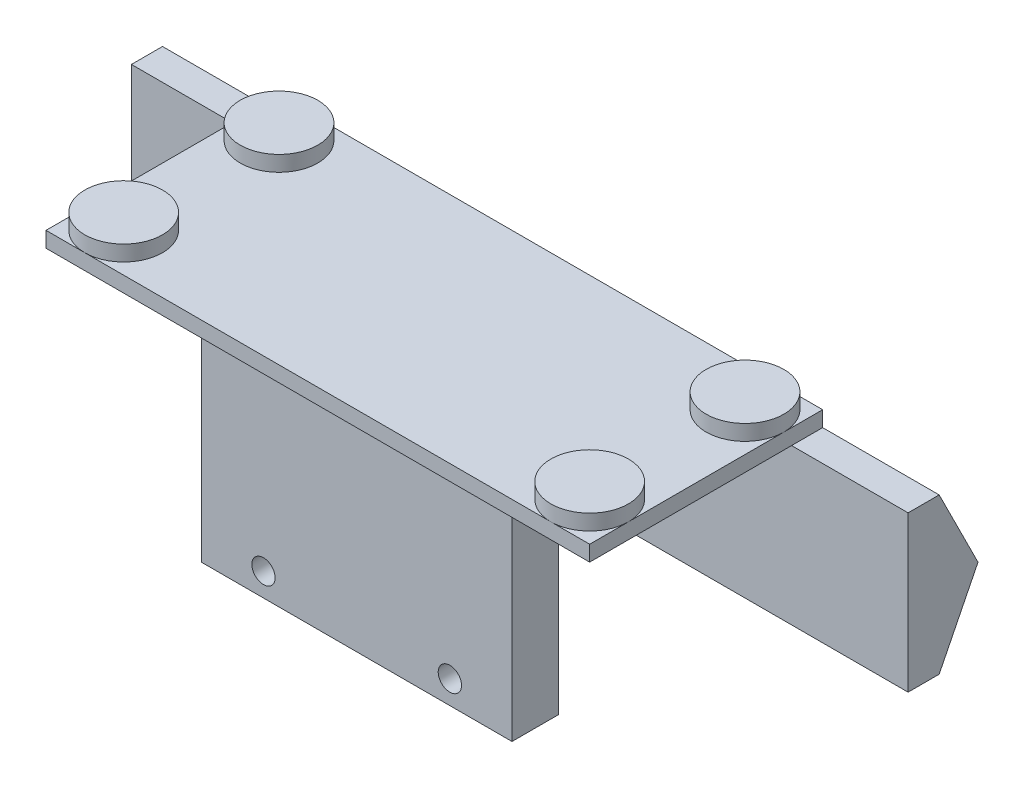
from build123d import *

# Parameters (mm, degrees)
SKETCH_1_W          = 70
SKETCH_1_H          = 30
EXTRUDE_1_DEPTH     = 2
SKETCH_2_R          = 5
EXTRUDE_2_DEPTH     = 4
SKETCH_3_W          = 100
SKETCH_3_H          = 20
EXTRUDE_3_DEPTH     = 4
EXTRUDE_5_DEPTH     = 100
SKETCH_7_W          = 40
SKETCH_7_H          = 30
EXTRUDE_7_DEPTH     = 6
CUT_EXTRUDE_1_REACH = 97
SKETCH_8_R          = 1.5
CUT_EXTRUDE_2_REACH = 95.814
SKETCH_10_R         = 14


with BuildPart() as part:
    # 草图1 → 凸台-拉伸1 (new body)
    with BuildSketch(Plane(origin=(0, 0, 0), x_dir=(1, 0, 0), z_dir=(0, 1, 0))):
        with Locations((35, 15)):
            Rectangle(SKETCH_1_W, SKETCH_1_H)
    extrude(amount=EXTRUDE_1_DEPTH)

    # 草图2 → 凸台-拉伸2 (add)
    with BuildSketch(Plane(origin=(0, 0, 0), x_dir=(1, 0, 0), z_dir=(0, 1, 0))):
        with Locations(Location((5, 25, 0), (0, 0, 90))):
            Circle(SKETCH_2_R)
        with Locations(Location((5, 5, 0), (0, 0, 270))):
            Circle(SKETCH_2_R)
        with Locations(Location((65, 25, 0), (0, 0, 90))):
            Circle(SKETCH_2_R)
        with Locations(Location((65, 5, 0), (0, 0, 270))):
            Circle(SKETCH_2_R)
    extrude(amount=EXTRUDE_2_DEPTH)

    # 草图3 → 凸台-拉伸3 (add)
    with BuildSketch(Plane(origin=(0, 0, -30), x_dir=(-1, 0, 0), z_dir=(0, 0, -1))):
        with Locations((-35, -10)):
            Rectangle(SKETCH_3_W, SKETCH_3_H)
    extrude(amount=-EXTRUDE_3_DEPTH)

    # 草图5 → 凸台-拉伸5 (add)
    with BuildSketch(Plane.ZY.offset(15)):
        Polygon((-30, 0), (-35, -10), (-30, -20), align=None)
    extrude(amount=-EXTRUDE_5_DEPTH)

    # 草图7 → 凸台-拉伸7 (add)
    with BuildSketch(Plane.XY.offset(-11)):
        with Locations((35, -15)):
            Rectangle(SKETCH_7_W, SKETCH_7_H)
    extrude(amount=EXTRUDE_7_DEPTH)

    # 草图8 → 切除-拉伸1 (cut, up to next)
    with BuildSketch(Plane.XY.offset(-5), mode=Mode.PRIVATE) as cut_extrude_1_sk1:
        with Locations((23, -3)):
            Circle(SKETCH_8_R)
    cut_extrude_1_tool1 = extrude(cut_extrude_1_sk1.sketch, amount=-CUT_EXTRUDE_1_REACH, mode=Mode.PRIVATE) & part.part
    # 草图8 → 切除-拉伸1 (cut, up to next)
    with BuildSketch(Plane.XY.offset(-5), mode=Mode.PRIVATE) as cut_extrude_1_sk2:
        with Locations((47, -3)):
            Circle(SKETCH_8_R)
    cut_extrude_1_tool2 = extrude(cut_extrude_1_sk2.sketch, amount=-CUT_EXTRUDE_1_REACH, mode=Mode.PRIVATE) & part.part
    # 草图8 → 切除-拉伸1 (cut, up to next)
    with BuildSketch(Plane.XY.offset(-5), mode=Mode.PRIVATE) as cut_extrude_1_sk3:
        with Locations((23, -27)):
            Circle(SKETCH_8_R)
    cut_extrude_1_tool3 = extrude(cut_extrude_1_sk3.sketch, amount=-CUT_EXTRUDE_1_REACH, mode=Mode.PRIVATE) & part.part
    # 草图8 → 切除-拉伸1 (cut, up to next)
    with BuildSketch(Plane.XY.offset(-5), mode=Mode.PRIVATE) as cut_extrude_1_sk4:
        with Locations((47, -27)):
            Circle(SKETCH_8_R)
    cut_extrude_1_tool4 = extrude(cut_extrude_1_sk4.sketch, amount=-CUT_EXTRUDE_1_REACH, mode=Mode.PRIVATE) & part.part
    add(cut_extrude_1_tool1.solids().sort_by_distance((23, -3, -5))[0], mode=Mode.SUBTRACT)
    add(cut_extrude_1_tool2.solids().sort_by_distance((47, -3, -5))[0], mode=Mode.SUBTRACT)
    add(cut_extrude_1_tool3.solids().sort_by_distance((23, -27, -5))[0], mode=Mode.SUBTRACT)
    add(cut_extrude_1_tool4.solids().sort_by_distance((47, -27, -5))[0], mode=Mode.SUBTRACT)

    # 草图10 → 切除-拉伸2 (cut, up to next)
    with BuildSketch(Plane.XY.offset(-26), mode=Mode.PRIVATE) as cut_extrude_2_sk1:
        with Locations((35, -15)):
            Circle(SKETCH_10_R)
    cut_extrude_2_tool1 = extrude(cut_extrude_2_sk1.sketch, amount=-CUT_EXTRUDE_2_REACH, mode=Mode.PRIVATE) & part.part
    add(cut_extrude_2_tool1.solids().sort_by_distance((35, -15, -26))[0], mode=Mode.SUBTRACT)


solid = part.part
